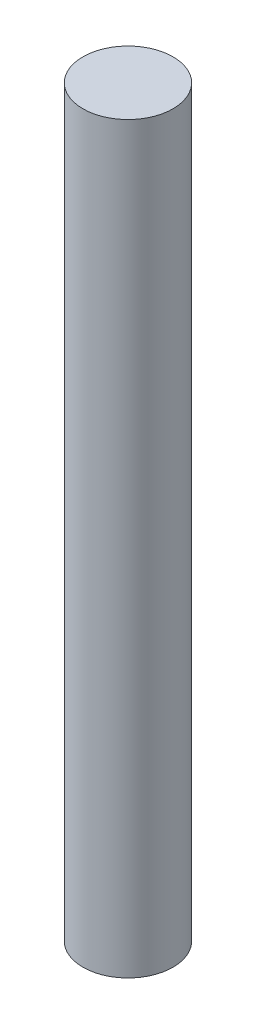
from build123d import *

# Parameters (mm, degrees)
SKETCH1_R           = 1
BOSS_EXTRUDE1_DEPTH = 16.5


with BuildPart() as part:
    # Sketch1 → Boss-Extrude1 (new body)
    with BuildSketch(Plane(origin=(0, 0, 0), x_dir=(1, 0, 0), z_dir=(0, 1, 0))):
        with Locations(Location((0, 0, 0), (0, 0, 270))):
            Circle(SKETCH1_R)
    extrude(amount=BOSS_EXTRUDE1_DEPTH)


solid = part.part
